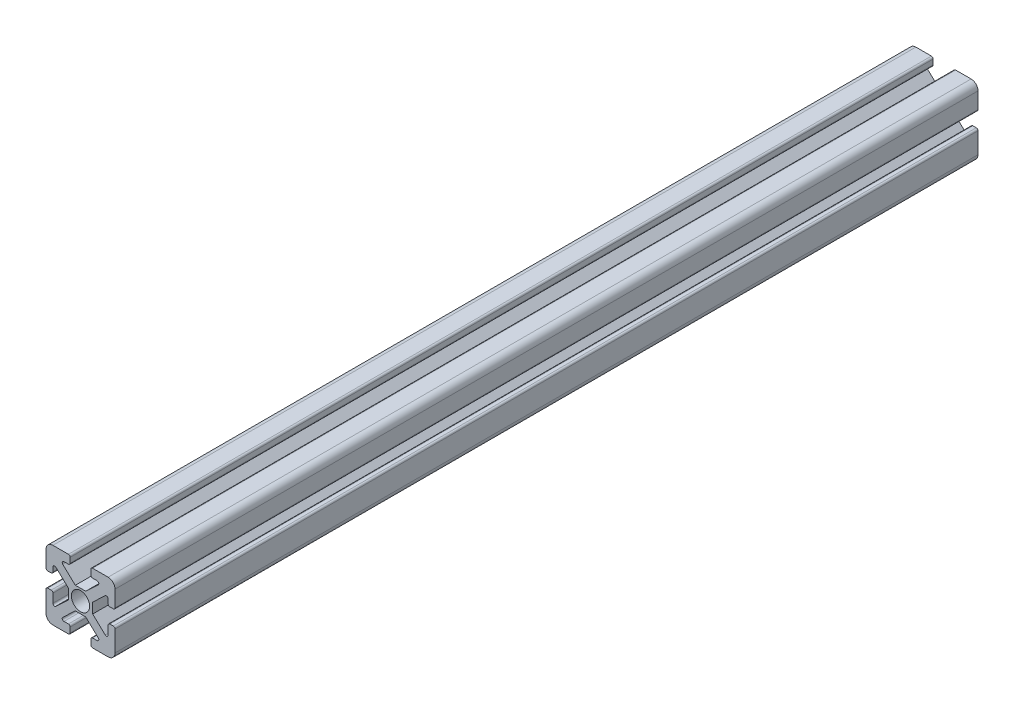
from build123d import *

# Parameters (mm, degrees)
SKETCH1_R           = 2.65
BOSS_EXTRUDE1_DEPTH = 250


with BuildPart() as part:
    # Sketch1 → Boss-Extrude1 (new body)
    with BuildSketch(Plane.XY):
        with BuildLine():
            Line((0, 2), (0, 8.007512652))
            ThreePointArc((0, 8.007512652), (0.146446609, 8.361066043), (0.5, 8.507512652))
            Line((0.5, 8.507512652), (1.5, 8.507512652))
            ThreePointArc((1.5, 8.507512652), (1.853553391, 8.361066043), (2, 8.007512652))
            Line((2, 8.007512652), (2, 5.451323229))
            ThreePointArc((2, 5.451323229), (2.301581692, 4.992378598), (2.842520699, 5.087071159))
            Line((2.842520699, 5.087071159), (6.485041399, 8.512278154))
            Line((6.485041399, 8.512278154), (6.485041399, 11.512278154))
            Line((6.485041399, 11.512278154), (2.842520699, 14.937485148))
            ThreePointArc((2.842520699, 14.937485148), (2.301581692, 15.03217771), (2, 14.573233078))
            Line((2, 14.573233078), (2, 13.307512652))
            ThreePointArc((2, 13.307512652), (1.853553391, 12.953959262), (1.5, 12.807512652))
            Line((1.5, 12.807512652), (0.5, 12.807512652))
            ThreePointArc((0.5, 12.807512652), (0.146446609, 12.953959262), (0, 13.307512652))
            Line((0, 13.307512652), (0, 18))
            ThreePointArc((0, 18), (0.585786438, 19.414213562), (2, 20))
            Line((2, 20), (6.5, 20))
            ThreePointArc((6.5, 20), (6.853553391, 19.853553391), (7, 19.5))
            Line((7, 19.5), (7, 18.017502122))
            ThreePointArc((7, 18.017502122), (6.853553391, 17.663948732), (6.5, 17.517502122))
            Line((6.5, 17.517502122), (5.2, 17.517502122))
            ThreePointArc((5.2, 17.517502122), (4.735174207, 17.201722052), (4.857479301, 16.653250052))
            Line((4.857479301, 16.653250052), (8.5, 13.228043058))
            Line((8.5, 13.228043058), (11.5, 13.228043058))
            Line((11.5, 13.228043058), (15.142520699, 16.653250052))
            ThreePointArc((15.142520699, 16.653250052), (15.264825793, 17.201722052), (14.8, 17.517502122))
            Line((14.8, 17.517502122), (13.5, 17.517502122))
            ThreePointArc((13.5, 17.517502122), (13.146446609, 17.663948732), (13, 18.017502122))
            Line((13, 18.017502122), (13, 19.5))
            ThreePointArc((13, 19.5), (13.146446609, 19.853553391), (13.5, 20))
            Line((13.5, 20), (18, 20))
            ThreePointArc((18, 20), (19.414213562, 19.414213562), (20, 18))
            Line((20, 18), (20, 13.307512652))
            ThreePointArc((20, 13.307512652), (19.853553391, 12.953959262), (19.5, 12.807512652))
            Line((19.5, 12.807512652), (18.5, 12.807512652))
            ThreePointArc((18.5, 12.807512652), (18.146446609, 12.953959262), (18, 13.307512652))
            Line((18, 13.307512652), (18, 14.573233078))
            ThreePointArc((18, 14.573233078), (17.698418308, 15.03217771), (17.157479301, 14.937485148))
            Line((17.157479301, 14.937485148), (13.514958601, 11.512278154))
            Line((13.514958601, 11.512278154), (13.514958601, 8.512278154))
            Line((13.514958601, 8.512278154), (17.157479301, 5.087071159))
            ThreePointArc((17.157479301, 5.087071159), (17.698418308, 4.992378598), (18, 5.451323229))
            Line((18, 5.451323229), (18, 8.007512652))
            ThreePointArc((18, 8.007512652), (18.146446609, 8.361066043), (18.5, 8.507512652))
            Line((18.5, 8.507512652), (19.5, 8.507512652))
            ThreePointArc((19.5, 8.507512652), (19.853553391, 8.361066043), (20, 8.007512652))
            Line((20, 8.007512652), (20, 2))
            ThreePointArc((20, 2), (19.414213562, 0.585786438), (18, 0))
            Line((18, 0), (13.5, 0))
            ThreePointArc((13.5, 0), (13.146446609, 0.146446609), (13, 0.5))
            Line((13, 0.5), (13, 2.007054185))
            ThreePointArc((13, 2.007054185), (13.146446609, 2.360607576), (13.5, 2.507054185))
            Line((13.5, 2.507054185), (14.8, 2.507054185))
            ThreePointArc((14.8, 2.507054185), (15.264825793, 2.822834256), (15.142520699, 3.371306255))
            Line((15.142520699, 3.371306255), (11.5, 6.79651325))
            Line((11.5, 6.79651325), (8.5, 6.79651325))
            Line((8.5, 6.79651325), (4.857479301, 3.371306255))
            ThreePointArc((4.857479301, 3.371306255), (4.735174207, 2.822834256), (5.2, 2.507054185))
            Line((5.2, 2.507054185), (6.5, 2.507054185))
            ThreePointArc((6.5, 2.507054185), (6.853553391, 2.360607576), (7, 2.007054185))
            Line((7, 2.007054185), (7, 0.5))
            ThreePointArc((7, 0.5), (6.853553391, 0.146446609), (6.5, 0))
            Line((6.5, 0), (2, 0))
            ThreePointArc((2, 0), (0.585786438, 0.585786438), (0, 2))
        make_face()
        with Locations((10, 10)):
            Circle(SKETCH1_R, mode=Mode.SUBTRACT)
    extrude(amount=BOSS_EXTRUDE1_DEPTH)


solid = part.part
